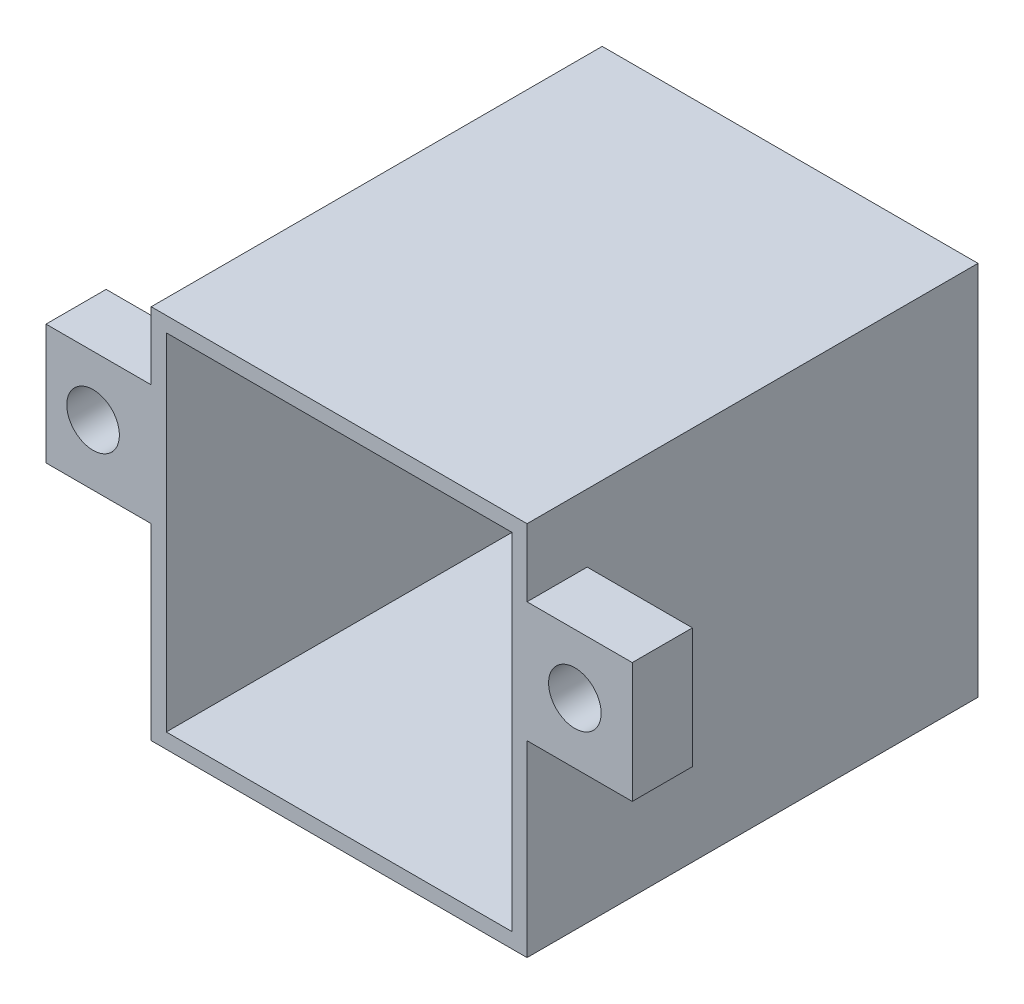
from build123d import *

# Parameters (mm, degrees)
SKETCH1_W           = 25
SKETCH1_H           = 25
BOSS_EXTRUDE2_DEPTH = 30
SHELL3_T            = -1
SKETCH4_R           = 5.25
CUT_EXTRUDE2_DEPTH  = 25
SKETCH5_W           = 7
SKETCH5_H           = 8
BOSS_EXTRUDE3_DEPTH = 4
SKETCH6_R           = 1.75
CUT_EXTRUDE3_DEPTH  = 10


with BuildPart() as part:
    # Sketch1 → Boss-Extrude2 (new body)
    with BuildSketch(Plane.XY):
        Rectangle(SKETCH1_W, SKETCH1_H)
    extrude(amount=BOSS_EXTRUDE2_DEPTH)

    # Shell3
    shell3_openings = [part.faces().sort_by_distance(p)[0] for p in [
        (0, 0, 30),
    ]]
    offset(amount=SHELL3_T, openings=shell3_openings, kind=Kind.INTERSECTION)

    # Sketch4 → Cut-Extrude2 (cut)
    with BuildSketch(Plane(origin=(0, 0, 0), x_dir=(-1, 0, 0), z_dir=(0, 0, -1))):
        Circle(SKETCH4_R)
    extrude(amount=-CUT_EXTRUDE2_DEPTH, mode=Mode.SUBTRACT)

    # Sketch5 → Boss-Extrude3 (add)
    with BuildSketch(Plane.XY.offset(30)):
        with Locations((16, 4)):
            Rectangle(SKETCH5_W, SKETCH5_H)
        with Locations((-16, 4)):
            Rectangle(SKETCH5_W, SKETCH5_H)
    extrude(amount=-BOSS_EXTRUDE3_DEPTH)

    # Sketch6 → Cut-Extrude3 (cut)
    with BuildSketch(Plane.XY.offset(30)):
        with Locations((15.682122387, 4.043264387)):
            Circle(SKETCH6_R)
        with Locations((-16.367627776, 4.043264387)):
            Circle(SKETCH6_R)
    extrude(amount=-CUT_EXTRUDE3_DEPTH, mode=Mode.SUBTRACT)


solid = part.part
